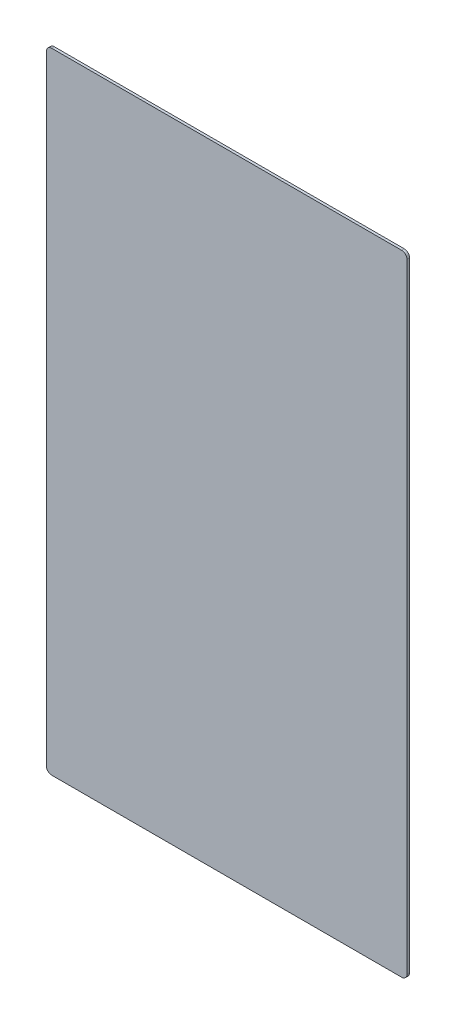
from build123d import *

# Parameters (mm, degrees)
SKETCH_1_W      = 690
SKETCH_1_H      = 1205
EXTRUDE_1_DEPTH = 5
FILLET_1_R      = 10


with BuildPart() as part:
    # 草图1 → 凸台-拉伸1 (new body)
    with BuildSketch(Plane.XY):
        Rectangle(SKETCH_1_W, SKETCH_1_H)
    extrude(amount=EXTRUDE_1_DEPTH)

    # 圆角1
    fillet_1_edges = [part.edges().sort_by_distance(p)[0] for p in [
        (345, -602.5, 2.5),
        (-345, -602.5, 2.5),
        (-345, 602.5, 2.5),
        (345, 602.5, 2.5),
    ]]
    fillet(fillet_1_edges, radius=FILLET_1_R)


solid = part.part
